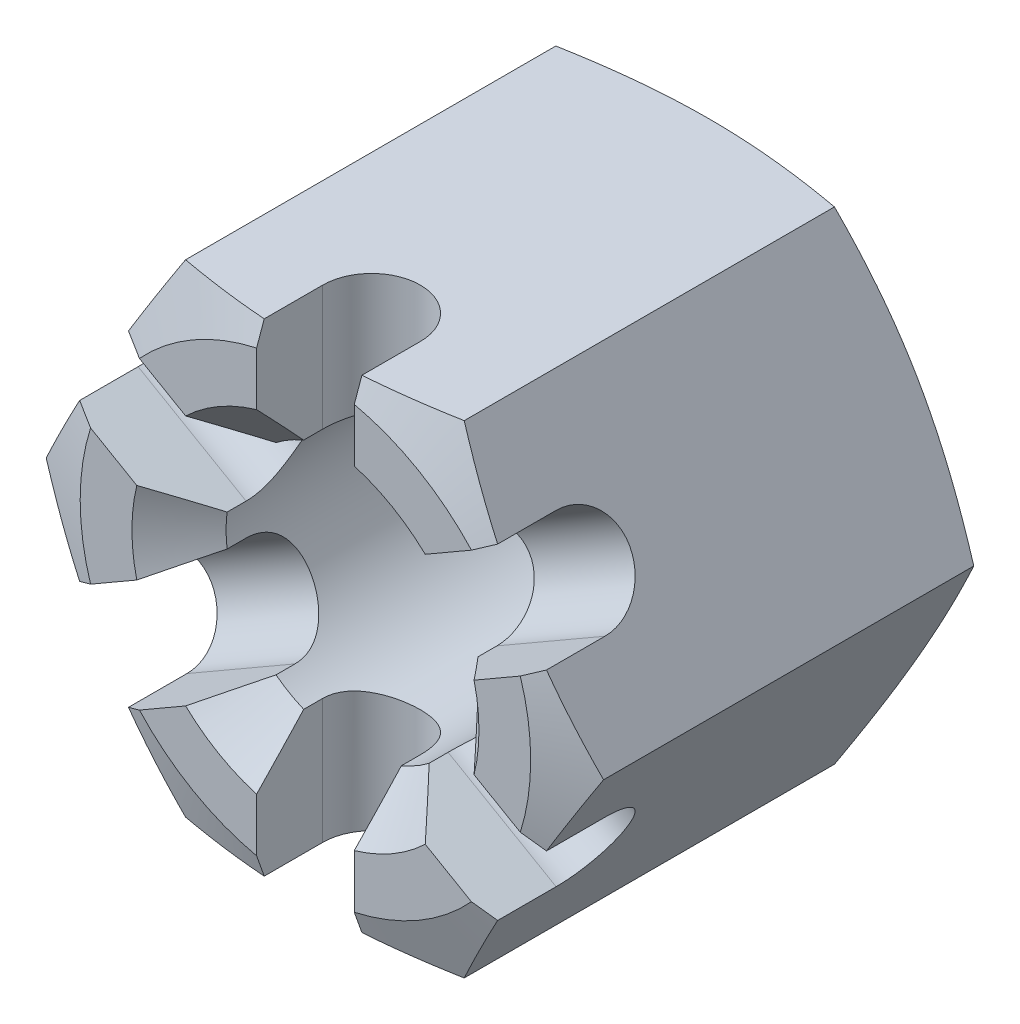
from build123d import *

# Parameters (mm, degrees)
BASENUT_DEPTH     = 17.8
SKETCH3_R         = 5.5
HOLE_DEPTH        = 28.12289531
SLOT_DEPTH        = 37.36697762
SLOTPATTERN_COUNT = 6


with BuildPart() as part:
    # Sketch1 → BaseNut (new body)
    with BuildSketch(Plane.XY):
        Polygon((6.062177826, -10.5), (12.124355653, 0), (6.062177826, 10.5), (-6.062177826, 10.5), (-12.124355653, 0), (-6.062177826, -10.5), align=None)
    extrude(amount=-BASENUT_DEPTH)

    # Sketch2 → Double-Chamfer (revolve, cut)
    with BuildSketch(Plane(origin=(-3.47179677, 0, -17.32820323), x_dir=(0, 0, -1), z_dir=(0, 1, 0))):
        Polygon((0.47179677, 6.32820323), (-0.374199502, 8.652558883), (0.47179677, 8.652558883), align=None)
        Polygon((-17.32820323, 6.32820323), (-17.32820323, 8.652558883), (-16.482206959, 8.652558883), align=None)
    revolve(axis=Axis((0, 0, -17.32820323), (0, 0, 1)), mode=Mode.SUBTRACT)

    # Sketch3 → Hole (cut, through all)
    with BuildSketch(Plane(origin=(-4.279914938, -1.735659213, -17.8), x_dir=(-1, 0, 0), z_dir=(0, 0, -1))):
        with Locations((-4.279914938, 1.735659213)):
            Circle(SKETCH3_R)
    extrude(amount=-HOLE_DEPTH, mode=Mode.SUBTRACT)

    # Sketch4 → EndChamfer (revolve, cut)
    with BuildSketch(Plane(origin=(-15.758283222, 0, -7.108283222), x_dir=(0, 0, -1), z_dir=(0, 1, 0)), mode=Mode.PRIVATE) as endchamfer_sk:
        Polygon((10.691716778, -23.308283222), (8.641716778, -21.258283222), (10.691716778, -21.258283222), align=None)
        Polygon((-7.108283222, -21.258283222), (-5.058283222, -21.258283222), (-7.108283222, -23.308283222), align=None)
    revolve(endchamfer_sk.sketch.rotate(Axis((0, 0, -7.108283222), (0, 0, 1)), 180), axis=Axis((0, 0, -7.108283222), (0, 0, 1)), mode=Mode.SUBTRACT)

    # Sketch5 → Slot (cut, through all)
    with BuildSketch(Plane(origin=(-17.8, 0, -17.8), x_dir=(0, 0, -1), z_dir=(0, 1, 0))):
        with BuildLine():
            Line((-17.8, -15.675), (-14.925, -15.675))
            ThreePointArc((-14.925, -15.675), (-12.8, -17.8), (-14.925, -19.925))
            Line((-14.925, -19.925), (-17.8, -19.925))
            Line((-17.8, -19.925), (-17.8, -15.675))
        make_face()
    slot = extrude(amount=-SLOT_DEPTH, mode=Mode.SUBTRACT)

    # SlotPattern: Slot ×6 about axis
    slotpattern_axis = Axis((0, 0, 0), (0, 0, 1))
    for i in range(1, SLOTPATTERN_COUNT):
        add(slot.rotate(slotpattern_axis, i * 360 / SLOTPATTERN_COUNT), mode=Mode.SUBTRACT)


solid = part.part
